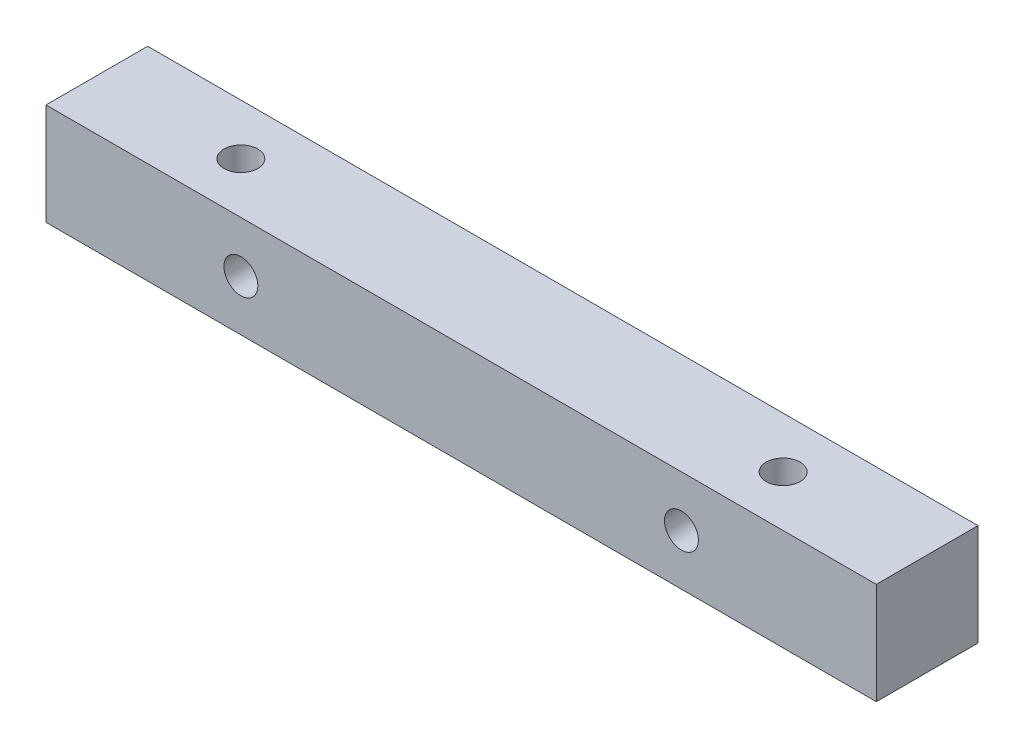
from build123d import *

# Parameters (mm, degrees)
SKETCH1_W                 = 6
SKETCH1_H                 = 6
BOSS_EXTRUDE1_DEPTH       = 49
F_2_0MM_DOWEL_HOLE1_D     = 2
F_2_0MM_DOWEL_HOLE1_DEPTH = 10
F_2_0MM_DOWEL_HOLE1_TIP   = 0.600860619
F_2_0MM_DOWEL_HOLE8_D     = 2
F_2_0MM_DOWEL_HOLE8_DEPTH = 10
F_2_0MM_DOWEL_HOLE8_TIP   = 0.600860619


with BuildPart() as part:
    # Sketch1 → Boss-Extrude1 (new body)
    with BuildSketch(Plane(origin=(0, 0, 0), x_dir=(0, 0, -1), z_dir=(1, 0, 0))):
        Rectangle(SKETCH1_W, SKETCH1_H)
    extrude(amount=BOSS_EXTRUDE1_DEPTH)

    # Ø2.0mm Dowel Hole1
    with Locations(Plane(origin=(11.5, 0, 3), x_dir=(0, 1, 0), z_dir=(0, 0, 1))):
        with Locations((0, 0), (0, -26)):
            Hole(F_2_0MM_DOWEL_HOLE1_D / 2, depth=F_2_0MM_DOWEL_HOLE1_DEPTH)
            with Locations((0, 0, -(F_2_0MM_DOWEL_HOLE1_DEPTH + F_2_0MM_DOWEL_HOLE1_TIP / 2))):  # 118° drill point
                Cone(0, F_2_0MM_DOWEL_HOLE1_D / 2, F_2_0MM_DOWEL_HOLE1_TIP, mode=Mode.SUBTRACT)

    # Ø2.0mm Dowel Hole8
    with Locations(Plane(origin=(8.5, 3, 0), x_dir=(0, 0, 1), z_dir=(0, 1, 0))):
        with Locations((0, 0), (0, 32)):
            Hole(F_2_0MM_DOWEL_HOLE8_D / 2, depth=F_2_0MM_DOWEL_HOLE8_DEPTH)
            with Locations((0, 0, -(F_2_0MM_DOWEL_HOLE8_DEPTH + F_2_0MM_DOWEL_HOLE8_TIP / 2))):  # 118° drill point
                Cone(0, F_2_0MM_DOWEL_HOLE8_D / 2, F_2_0MM_DOWEL_HOLE8_TIP, mode=Mode.SUBTRACT)


solid = part.part
